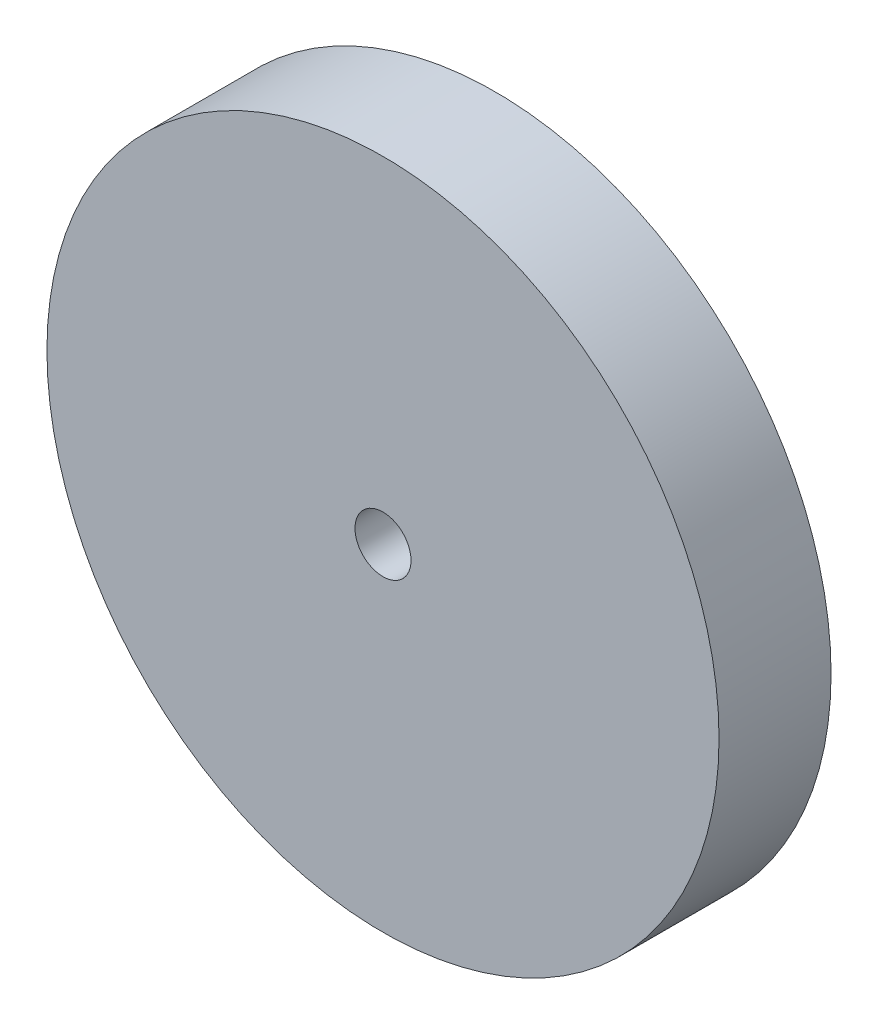
from build123d import *

# Parameters (mm, degrees)
SKETCH1_R           = 38.1
SKETCH1_R_2         = 3.175
BOSS_EXTRUDE1_DEPTH = 12.7


with BuildPart() as part:
    # Sketch1 → Boss-Extrude1 (new body)
    with BuildSketch(Plane.XY):
        Circle(SKETCH1_R)
        Circle(SKETCH1_R_2, mode=Mode.SUBTRACT)
    extrude(amount=BOSS_EXTRUDE1_DEPTH)


solid = part.part
